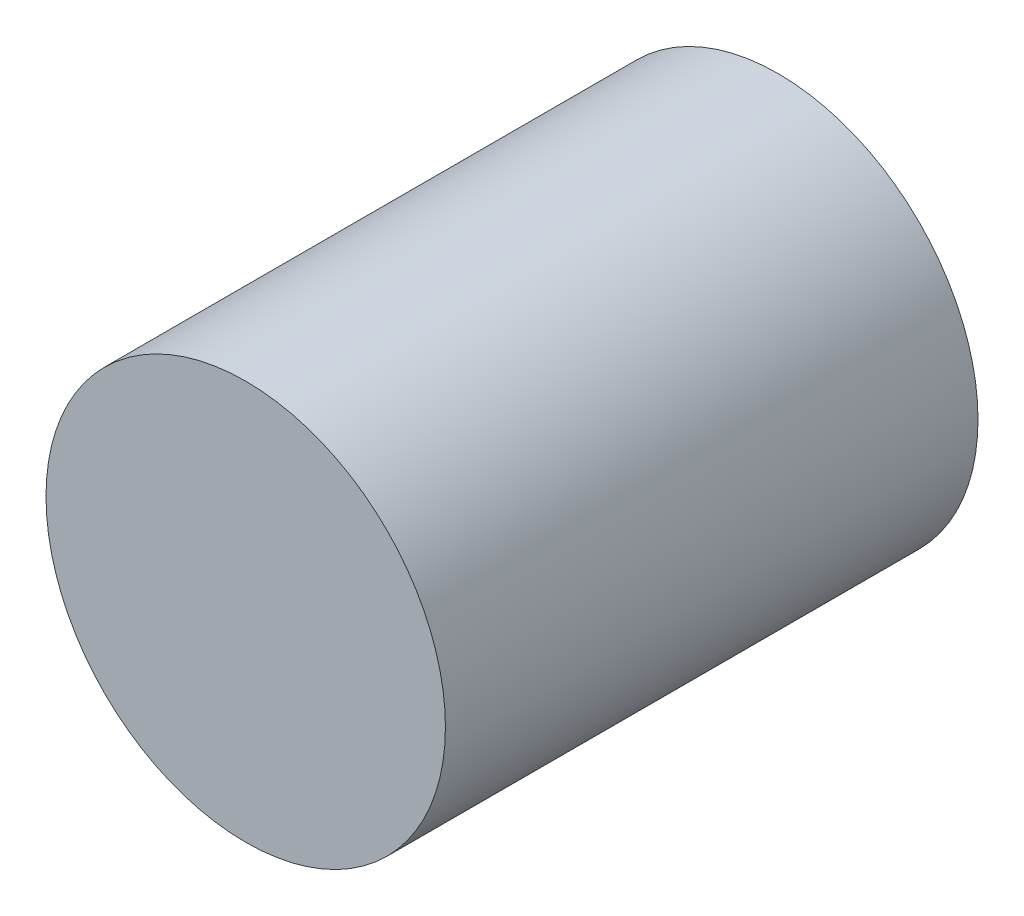
from build123d import *

# Parameters (mm, degrees)
SKETCH2_R           = 6
BOSS_EXTRUDE1_DEPTH = 16
SKETCH3_R           = 3
CUT_EXTRUDE1_DEPTH  = 15.8


with BuildPart() as part:
    # Sketch2 → Boss-Extrude1 (new body)
    with BuildSketch(Plane.XY):
        Circle(SKETCH2_R)
    extrude(amount=BOSS_EXTRUDE1_DEPTH)

    # Sketch3 → Cut-Extrude1 (cut)
    with BuildSketch(Plane(origin=(0, 0, 0), x_dir=(-1, 0, 0), z_dir=(0, 0, -1))):
        Circle(SKETCH3_R)
    extrude(amount=-CUT_EXTRUDE1_DEPTH, mode=Mode.SUBTRACT)


solid = part.part
